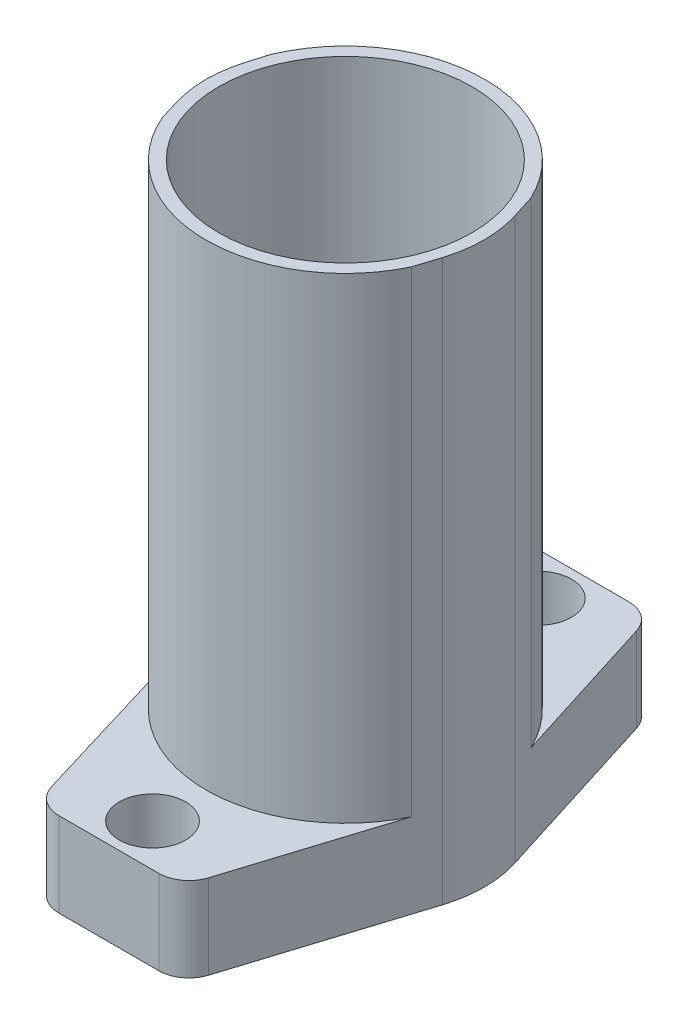
from build123d import *

# Parameters (mm, degrees)
SKETCH_1_R          = 2.75
SKETCH_1_R_2        = 3.25
EXTRUDE_1_DEPTH     = 46.5
CUT_EXTRUDE_START   = -21.5
SKETCH_2_R          = 10.5
SKETCH_2_R_2        = 3.25
SKETCH_2_R_3        = 2.75
CUT_EXTRUDE_1_DEPTH = 21.5
SKETCH_4_R          = 5
CUT_EXTRUDE_3_DEPTH = 15
CUT_EXTRUDE_START_2 = -13
CUT_EXTRUDE_4_DEPTH = 13
FILLET_1_R          = 2.5
CUT_EXTRUDE_5_DEPTH = 5


with BuildPart() as part:
    # 草图1 → 凸台-拉伸1 (new body)
    with BuildSketch(Plane(origin=(0, 0, 0), x_dir=(1, 0, 0), z_dir=(0, 1, 0))):
        with BuildLine():
            Line((-6.112211857, 19.5), (5.859179501, 19.5))
            Line((5.859179501, 19.5), (11.054087418, 3.00371837))
            ThreePointArc((11.054087418, 3.00371837), (11.515865574, 0), (11.054087418, -3.00371837))
            Line((11.054087418, -3.00371837), (5.859179501, -19.5))
            Line((5.859179501, -19.5), (-6.112211857, -19.5))
            Line((-6.112211857, -19.5), (-11.127250475, -2.890493903))
            ThreePointArc((-11.127250475, -2.890493903), (-11.554108619, 0), (-11.127250475, 2.890493903))
            Line((-11.127250475, 2.890493903), (-6.112211857, 19.5))
        make_face()
        with Locations(Location((0, 16, 0), (0, 0, 90))):
            Circle(SKETCH_1_R, mode=Mode.SUBTRACT)
        with Locations(Location((0, 0, 0), (0, 0, 90))):
            Circle(SKETCH_1_R_2, mode=Mode.SUBTRACT)
        with Locations(Location((0, -16, 0), (0, 0, 90))):
            Circle(SKETCH_1_R, mode=Mode.SUBTRACT)
    extrude(amount=EXTRUDE_1_DEPTH)

    # 草图2 → 切除-拉伸1 (cut)
    # profile 1 of 3: a face of its own
    with BuildSketch(Plane(origin=(0, 46.5, 0), x_dir=(1, 0, 0), z_dir=(0, 1, 0)).offset(CUT_EXTRUDE_START)):
        with Locations(Location((0, 0, 0), (0, 0, 270))):
            Circle(SKETCH_2_R)
        with Locations(Location((0, 0, 0), (0, 0, 90))):
            Circle(SKETCH_2_R_2, mode=Mode.SUBTRACT)
    # profile 2 of 3: a face of its own
    with BuildSketch(Plane(origin=(0, 46.5, 0), x_dir=(1, 0, 0), z_dir=(0, 1, 0)).offset(CUT_EXTRUDE_START)):
        with BuildLine():
            Line((-6.112211857, 19.5), (-10.640039201, 4.504108324))
            ThreePointArc((-10.640039201, 4.504108324), (-0.240464733, 11.551606066), (10.443383029, 4.942992707))
            Line((10.443383029, 4.942992707), (5.859179501, 19.5))
            Line((5.859179501, 19.5), (-6.112211857, 19.5))
        make_face()
        with Locations(Location((0, 16, 0), (0, 0, 90))):
            Circle(SKETCH_2_R_3, mode=Mode.SUBTRACT)
    # profile 3 of 3: a face of its own
    with BuildSketch(Plane(origin=(0, 46.5, 0), x_dir=(1, 0, 0), z_dir=(0, 1, 0)).offset(CUT_EXTRUDE_START)):
        with BuildLine():
            Line((-6.112211857, -19.5), (5.859179501, -19.5))
            Line((5.859179501, -19.5), (10.443383029, -4.942992707))
            ThreePointArc((10.443383029, -4.942992707), (-0.240464733, -11.551606066), (-10.640039201, -4.504108324))
            Line((-10.640039201, -4.504108324), (-6.112211857, -19.5))
        make_face()
        with Locations(Location((0, -16, 0), (0, 0, 90))):
            Circle(SKETCH_2_R_3, mode=Mode.SUBTRACT)
    extrude(amount=CUT_EXTRUDE_1_DEPTH, mode=Mode.SUBTRACT)

    # 草图4 → 切除-拉伸3 (cut)
    with BuildSketch(Plane.XZ):
        with Locations(Location((0, 0, 0), (0, 0, 270))):
            Circle(SKETCH_4_R)
    extrude(amount=-CUT_EXTRUDE_3_DEPTH, mode=Mode.SUBTRACT)

    # 草图5 → 切除-拉伸4 (cut)
    with BuildSketch(Plane(origin=(0, 25, 0), x_dir=(1, 0, 0), z_dir=(0, 1, 0)).offset(CUT_EXTRUDE_START_2)):
        with BuildLine():
            Line((10.443383029, 4.942992707), (5.859179501, 19.5))
            Line((5.859179501, 19.5), (-6.112211857, 19.5))
            Line((-6.112211857, 19.5), (-10.640039201, 4.504108324))
            ThreePointArc((-10.640039201, 4.504108324), (-0.240464733, 11.551606066), (10.443383029, 4.942992707))
        make_face()
        with BuildLine():
            Line((-10.640039201, -4.504108324), (-6.112211857, -19.5))
            Line((-6.112211857, -19.5), (5.859179501, -19.5))
            Line((5.859179501, -19.5), (10.443383029, -4.942992707))
            ThreePointArc((10.443383029, -4.942992707), (-0.240464733, -11.551606066), (-10.640039201, -4.504108324))
        make_face()
    extrude(amount=CUT_EXTRUDE_4_DEPTH, mode=Mode.SUBTRACT)

    # 圆角1
    fillet_1_edges = [part.edges().sort_by_distance(p)[0] for p in [
        (5.859179501, 6, 19.5),
        (-6.112211857, 6, 19.5),
        (-6.112211857, 6, -19.5),
        (5.859179501, 6, -19.5),
    ]]
    fillet(fillet_1_edges, radius=FILLET_1_R)

    # 草图6 → 切除-拉伸5 (cut)
    with BuildSketch(Plane(origin=(0, 12, 0), x_dir=(1, 0, 0), z_dir=(0, 1, 0))):
        with BuildLine():
            Line((10.443383029, 4.942992707), (6.409986035, 17.750929593))
            ThreePointArc((6.409986035, 17.750929593), (5.504057643, 19.015852671), (4.025430574, 19.5))
            Line((4.025430574, 19.5), (-4.255583645, 19.5))
            ThreePointArc((-4.255583645, 19.5), (-5.74612739, 19.007057385), (-6.648869109, 17.722623476))
            Line((-6.648869109, 17.722623476), (-10.640039201, 4.504108324))
            ThreePointArc((-10.640039201, 4.504108324), (-0.240464733, 11.551606066), (10.443383029, 4.942992707))
        make_face()
        with BuildLine():
            Line((-10.640039201, -4.504108324), (-6.648869109, -17.722623476))
            ThreePointArc((-6.648869109, -17.722623476), (-5.74612739, -19.007057385), (-4.255583645, -19.5))
            Line((-4.255583645, -19.5), (4.025430574, -19.5))
            ThreePointArc((4.025430574, -19.5), (5.504057643, -19.015852671), (6.409986035, -17.750929593))
            Line((6.409986035, -17.750929593), (10.443383029, -4.942992707))
            ThreePointArc((10.443383029, -4.942992707), (-0.240464733, -11.551606066), (-10.640039201, -4.504108324))
        make_face()
    extrude(amount=-CUT_EXTRUDE_5_DEPTH, mode=Mode.SUBTRACT)


solid = part.part
